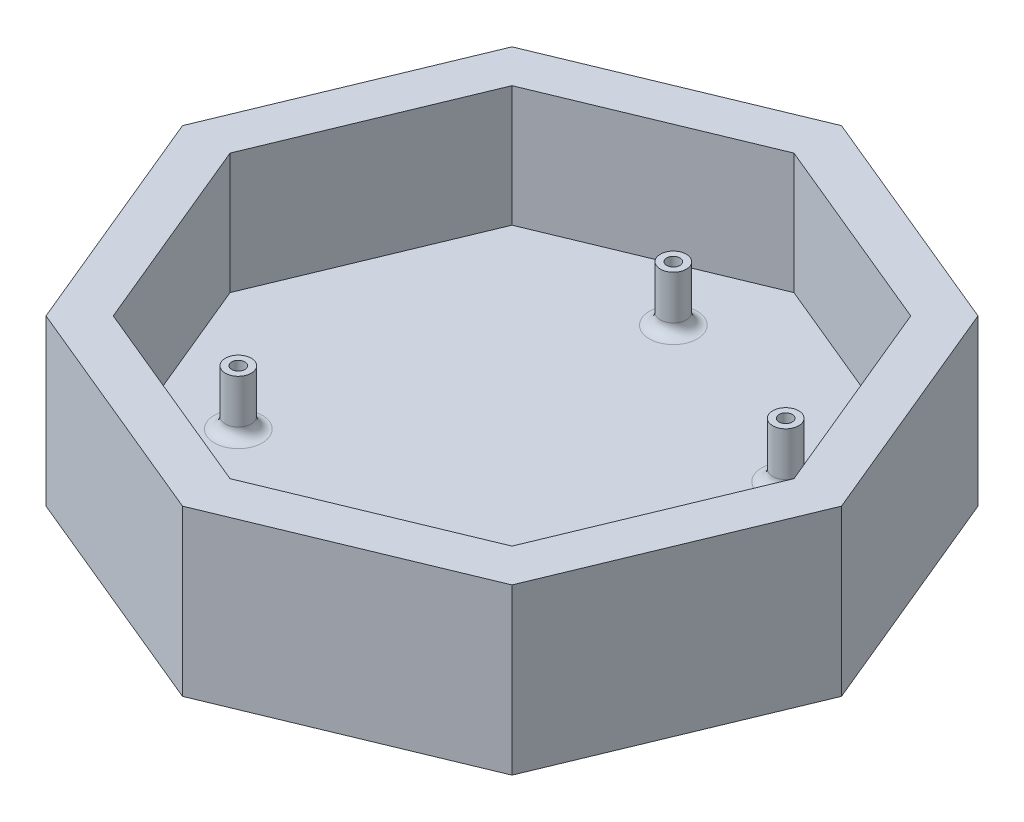
from build123d import *

# Parameters (mm, degrees)
BOSS_EXTRUDE1_DEPTH             = 38.1
SHELL1_T                        = -10.16
SKETCH5_R                       = 3.000653817
BOSS_EXTRUDE2_DEPTH             = 12.7
FILLET2_R                       = 2.54
TAP_DRILL_FOR_4_HELICOIL2_D     = 3.048
TAP_DRILL_FOR_4_HELICOIL2_DEPTH = 8.89
TAP_DRILL_FOR_4_HELICOIL2_TIP   = 0.915711583


with BuildPart() as part:
    # Sketch1 → Boss-Extrude1 (new body)
    with BuildSketch(Plane(origin=(0, 0, 0), x_dir=(1, 0, 0), z_dir=(0, 1, 0))):
        Polygon((76.2, 0), (53.881536726, 53.881536726), (0, 76.2), (-53.881536726, 53.881536726), (-76.2, 0), (-53.881536726, -53.881536726), (0, -76.2), (53.881536726, -53.881536726), align=None)
    extrude(amount=BOSS_EXTRUDE1_DEPTH)

    # Shell1
    shell1_openings = [part.faces().sort_by_distance(p)[0] for p in [
        (0, 38.1, 0),
    ]]
    offset(amount=SHELL1_T, openings=shell1_openings, kind=Kind.INTERSECTION)

    # Sketch5 → Boss-Extrude2 (add)
    with BuildSketch(Plane(origin=(0, 10.16, 0), x_dir=(1, 0, 0), z_dir=(0, 1, 0))):
        with Locations(Location((-7.439796634, 44.753764378, 0), (0, 0, 270))):
            Circle(SKETCH5_R)
        with Locations(Location((36.906420926, 26.384959625, 0), (0, 0, 90))):
            Circle(SKETCH5_R)
        with Locations(Location((7.439796634, -44.753764378, 0), (0, 0, 270))):
            Circle(SKETCH5_R)
        with Locations(Location((-36.906420926, -26.384959625, 0), (0, 0, 90))):
            Circle(SKETCH5_R)
    extrude(amount=BOSS_EXTRUDE2_DEPTH)

    # Fillet2
    fillet2_edges = [part.edges().sort_by_distance(p)[0] for p in [
        (-7.439796634, 10.16, -47.754418196),
        (36.906420926, 10.16, -23.384305808),
        (7.439796634, 10.16, 41.753110561),
        (-36.906420926, 10.16, 29.385613442),
    ]]
    fillet(fillet2_edges, radius=FILLET2_R)

    # Tap Drill for #4 Helicoil2
    with Locations(Plane(origin=(0, 22.86, 0), x_dir=(1, 0, 0), z_dir=(0, 1, 0))):
        with Locations((-7.439796634, 44.753764378), (36.906420926, 26.384959625), (7.439796634, -44.753764378), (-36.906420926, -26.384959625)):
            Hole(TAP_DRILL_FOR_4_HELICOIL2_D / 2, depth=TAP_DRILL_FOR_4_HELICOIL2_DEPTH)
            with Locations((0, 0, -(TAP_DRILL_FOR_4_HELICOIL2_DEPTH + TAP_DRILL_FOR_4_HELICOIL2_TIP / 2))):  # 118° drill point
                Cone(0, TAP_DRILL_FOR_4_HELICOIL2_D / 2, TAP_DRILL_FOR_4_HELICOIL2_TIP, mode=Mode.SUBTRACT)


solid = part.part
